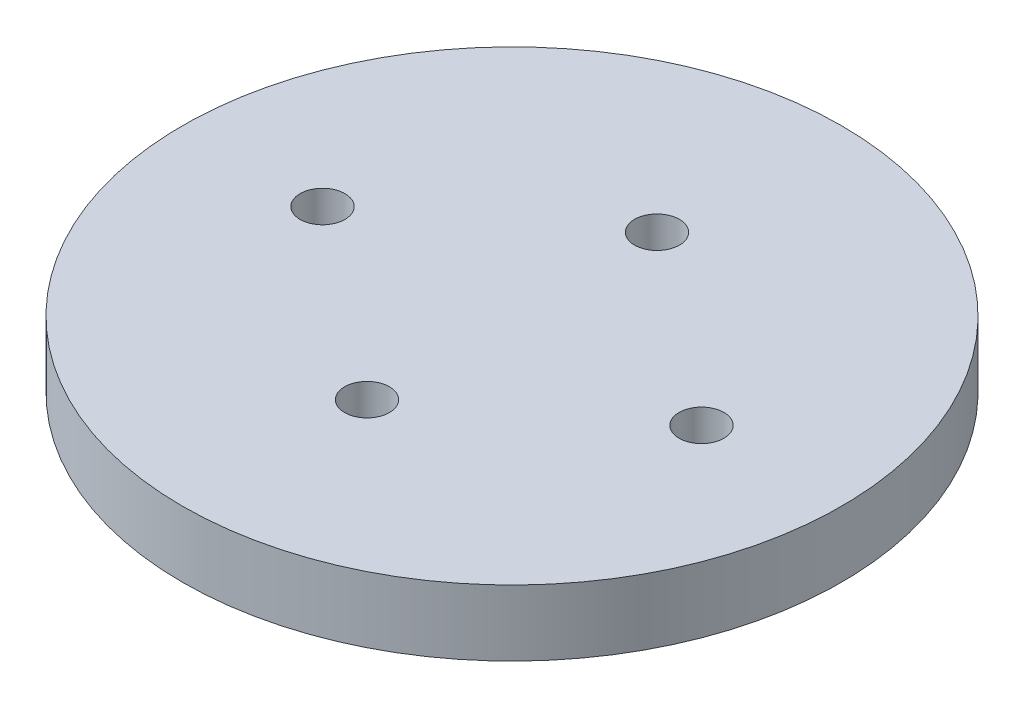
from build123d import *

# Parameters (mm, degrees)
SKETCH1_R           = 25
SKETCH1_R_2         = 1.7
BOSS_EXTRUDE1_DEPTH = 5


with BuildPart() as part:
    # Sketch1 → Boss-Extrude1 (new body)
    with BuildSketch(Plane(origin=(0, 0, 0), x_dir=(1, 0, 0), z_dir=(0, 1, 0))):
        with Locations(Location((0, 0, 0), (0, 0, 270))):
            Circle(SKETCH1_R)
        with Locations(Location((0, -11, 0), (0, 0, 270))):
            Circle(SKETCH1_R_2, mode=Mode.SUBTRACT)
        with Locations(Location((0, 11, 0), (0, 0, 270))):
            Circle(SKETCH1_R_2, mode=Mode.SUBTRACT)
        with Locations(Location((14.375, 0, 0), (0, 0, 270))):
            Circle(SKETCH1_R_2, mode=Mode.SUBTRACT)
        with Locations(Location((-14.375, 0, 0), (0, 0, 270))):
            Circle(SKETCH1_R_2, mode=Mode.SUBTRACT)
    extrude(amount=BOSS_EXTRUDE1_DEPTH)


solid = part.part
